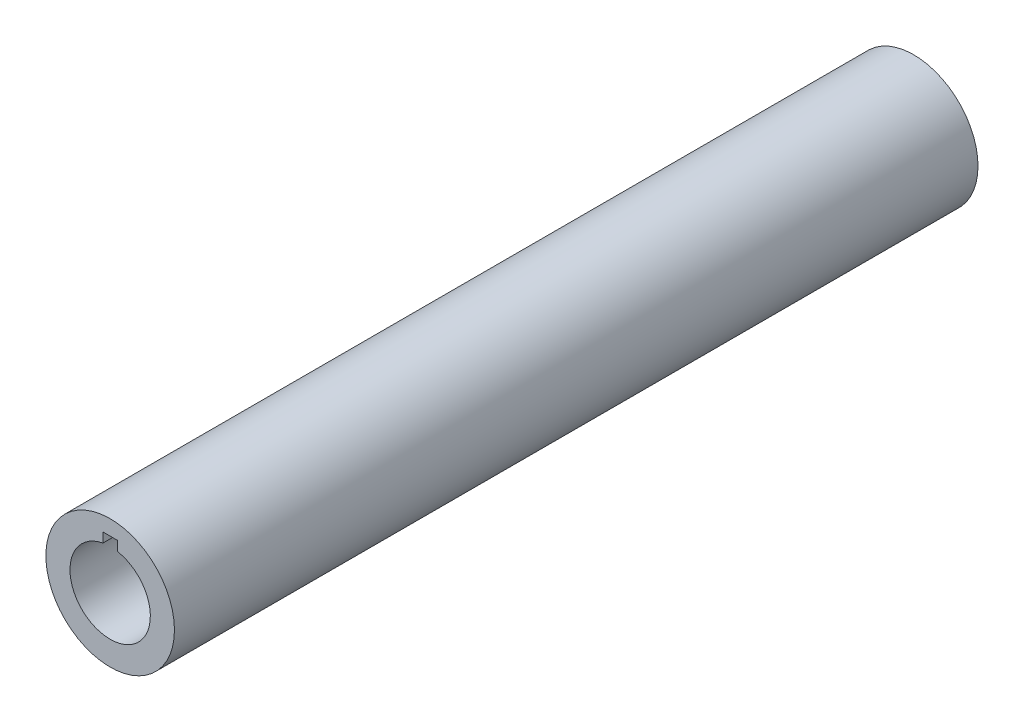
from build123d import *

# Parameters (mm, degrees)
CROQUIS2_R              = 4
SALIENTE_EXTRUIR1_DEPTH = 50


with BuildPart() as part:
    # Croquis2 → Saliente-Extruir1 (new body)
    with BuildSketch(Plane.XY):
        Circle(CROQUIS2_R)
        with BuildLine():
            Line((-0.45, 2.459166525), (-0.45, 3.059166525))
            Line((-0.45, 3.059166525), (0.45, 3.059166525))
            Line((0.45, 3.059166525), (0.45, 2.459166525))
            ThreePointArc((0.45, 2.459166525), (0, -2.5), (-0.45, 2.459166525))
        make_face(mode=Mode.SUBTRACT)
    extrude(amount=SALIENTE_EXTRUIR1_DEPTH)


solid = part.part
